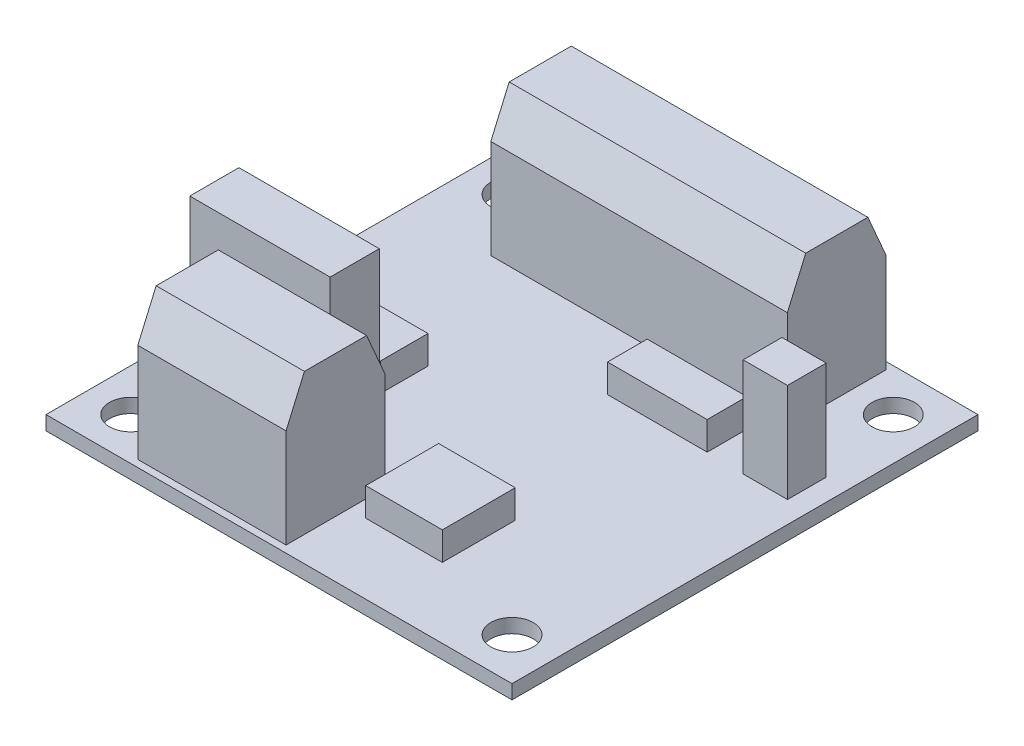
from build123d import *

# Parameters (mm, degrees)
SKETCH1_W           = 33
SKETCH1_H           = 33
SKETCH1_R           = 1.5
BOSS_EXTRUDE1_DEPTH = 0.5
SKETCH2_W           = 21
SKETCH2_H           = 7
SKETCH2_W_2         = 10.5
SKETCH2_W_3         = 9.939031212
SKETCH2_H_2         = 3.481183521
BOSS_EXTRUDE2_DEPTH = 10
SKETCH3_W           = 5.42424951
SKETCH3_H           = 5.162839894
SKETCH3_W_2         = 7.058059603
SKETCH3_H_2         = 2.81015336
SKETCH3_W_3         = 3.790439417
SKETCH3_H_3         = 3.365648792
BOSS_EXTRUDE3_DEPTH = 2
SKETCH4_W           = 3.136915379
SKETCH4_H           = 2.744800957
BOSS_EXTRUDE4_DEPTH = 7
CUT_EXTRUDE1_DEPTH  = 24


with BuildPart() as part:
    # Sketch1 → Boss-Extrude1 (new, symmetric)
    with BuildSketch(Plane(origin=(0, 0, 0), x_dir=(1, 0, 0), z_dir=(0, 1, 0))):
        Rectangle(SKETCH1_W, SKETCH1_H)
        with Locations(Location((-13.5, 13.5, 0), (0, 0, 270))):
            Circle(SKETCH1_R, mode=Mode.SUBTRACT)
        with Locations(Location((-13.5, -13.5, 0), (0, 0, 90))):
            Circle(SKETCH1_R, mode=Mode.SUBTRACT)
        with Locations(Location((13.5, -13.5, 0), (0, 0, 270))):
            Circle(SKETCH1_R, mode=Mode.SUBTRACT)
        with Locations(Location((13.5, 13.5, 0), (0, 0, 90))):
            Circle(SKETCH1_R, mode=Mode.SUBTRACT)
    extrude(amount=BOSS_EXTRUDE1_DEPTH, both=True)

    # Sketch2 → Boss-Extrude2 (add)
    with BuildSketch(Plane(origin=(0, 0.5, 0), x_dir=(1, 0, 0), z_dir=(0, 1, 0))):
        with Locations((0, 12.5)):
            Rectangle(SKETCH2_W, SKETCH2_H)
        with Locations((-5.25, -12.5)):
            Rectangle(SKETCH2_W_2, SKETCH2_H)
        with Locations((-9.842504173, -6.265483719)):
            Rectangle(SKETCH2_W_3, SKETCH2_H_2)
    extrude(amount=BOSS_EXTRUDE2_DEPTH)

    # Sketch3 → Boss-Extrude3 (add)
    with BuildSketch(Plane(origin=(0, 0.5, 0), x_dir=(1, 0, 0), z_dir=(0, 1, 0))):
        with Locations((3.888468022, -8.953279311)):
            Rectangle(SKETCH3_W, SKETCH3_H)
        with Locations((5.685659125, 6.012421143)):
            Rectangle(SKETCH3_W_2, SKETCH3_H_2)
        with Locations((-7.842288448, -1.682824396)):
            Rectangle(SKETCH3_W_3, SKETCH3_H_3)
    extrude(amount=BOSS_EXTRUDE3_DEPTH)

    # Sketch4 → Boss-Extrude4 (add)
    with BuildSketch(Plane(origin=(0, 0.5, 0), x_dir=(1, 0, 0), z_dir=(0, 1, 0))):
        with Locations((13.397242764, 5.914392538)):
            Rectangle(SKETCH4_W, SKETCH4_H)
    extrude(amount=BOSS_EXTRUDE4_DEPTH)

    # Sketch5 → Cut-Extrude1 (cut)
    with BuildSketch(Plane(origin=(10.5, 0, 0), x_dir=(0, 0, -1), z_dir=(1, 0, 0))):
        Polygon((-16, 10.5), (-16, 7.5), (-14.7, 10.5), align=None)
        Polygon((-10.3, 10.5), (-9, 10.5), (-9, 7.5), align=None)
        Polygon((9, 7.5), (10.3, 10.5), (9, 10.5), align=None)
        Polygon((16, 10.5), (14.7, 10.5), (16, 7.5), align=None)
    extrude(amount=-CUT_EXTRUDE1_DEPTH, mode=Mode.SUBTRACT)


solid = part.part
